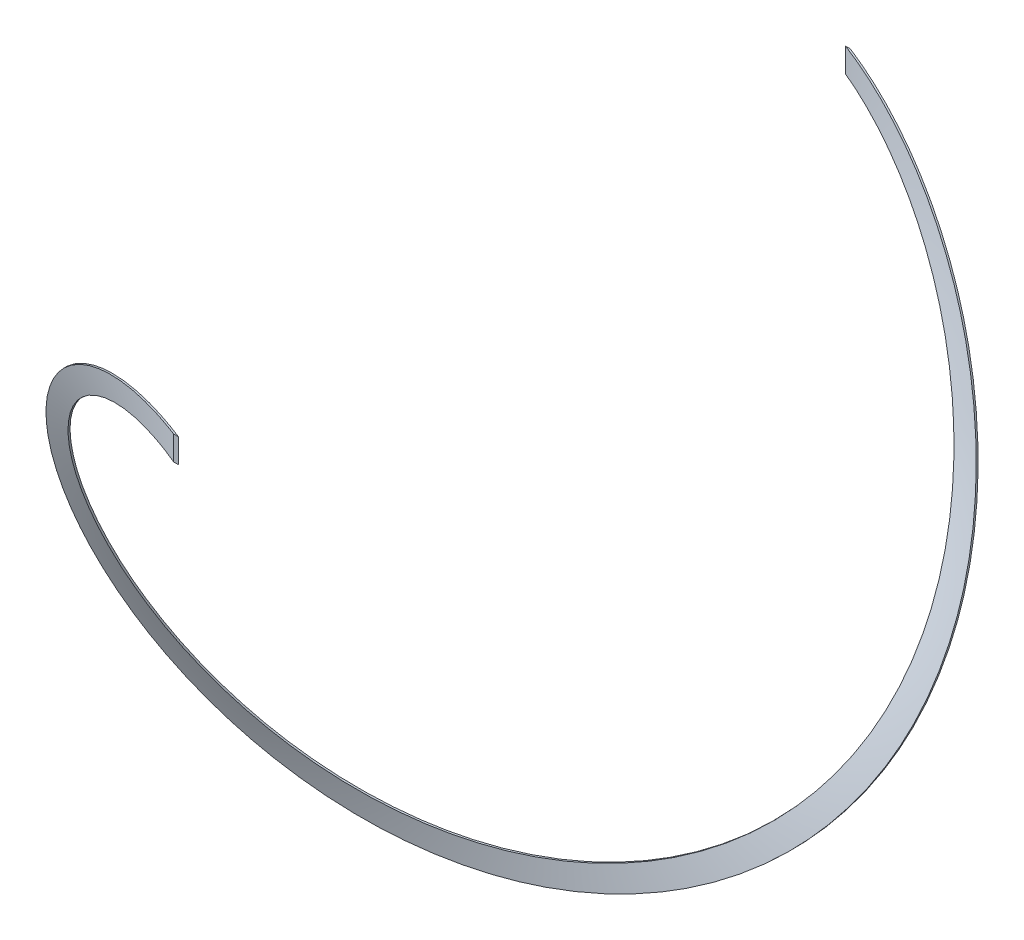
from build123d import *

# Parameters (mm, degrees)
SWEEP1_PITCH       = 833
SWEEP1_HEIGHT      = 833
SWEEP1_RADIUS      = 342.4
SWEEP1_START_ANGLE = -180
SKETCH2_W          = 6
SKETCH2_H          = 30


with BuildPart() as part:
    # Sweep1: sweep along a helix
    with BuildLine() as sweep1_path:
        add(Helix(SWEEP1_PITCH, SWEEP1_HEIGHT, SWEEP1_RADIUS, center=(0, 0, 0), direction=(0, 0, 1), lefthand=True, mode=Mode.PRIVATE).rotate(Axis((0, 0, 0), (0, 0, 1)), SWEEP1_START_ANGLE))
    # Sketch2 → Sweep1 (sweep)
    with BuildSketch(Plane.XY):
        with Locations((0, 327.4)):
            Rectangle(SKETCH2_W, SKETCH2_H)
    sweep(path=sweep1_path.line, is_frenet=True)


solid = part.part
